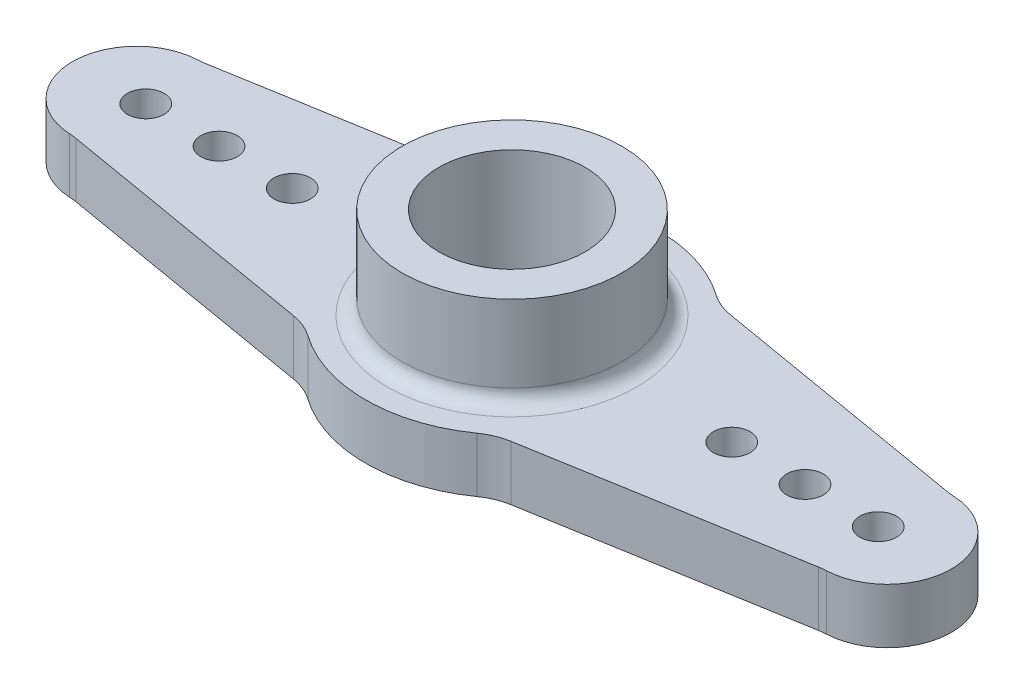
from build123d import *

# Parameters (mm, degrees)
BOSS_EXTRUDE1_DEPTH = 2.38125
FILLET1_R           = 2.54
FILLET2_R           = 2.54
SKETCH2_R           = 4.7625
BOSS_EXTRUDE2_DEPTH = 3.96875
FILLET3_R           = 0.635
SKETCH3_R           = 3.175
CUT_EXTRUDE1_DEPTH  = 6.35
SKETCH4_R           = 0.79375
CUT_EXTRUDE2_DEPTH  = 6.35


with BuildPart() as part:
    # Sketch1 → Boss-Extrude1 (new body)
    with BuildSketch(Plane(origin=(0, 0, 0), x_dir=(1, 0, 0), z_dir=(0, 1, 0))):
        with BuildLine():
            Line((4.089179599, 4.858097386), (16.271875, 2.778125))
            ThreePointArc((16.271875, 2.778125), (19.05, 0), (16.271875, -2.778125))
            Line((16.271875, -2.778125), (4.089179599, -4.858097386))
            ThreePointArc((4.089179599, -4.858097386), (0, -6.35), (-4.089179599, -4.858097386))
            Line((-4.089179599, -4.858097386), (-16.271875, -2.778125))
            ThreePointArc((-16.271875, -2.778125), (-19.05, 0), (-16.271875, 2.778125))
            Line((-16.271875, 2.778125), (-4.089179599, 4.858097386))
            ThreePointArc((-4.089179599, 4.858097386), (0, 6.35), (4.089179599, 4.858097386))
        make_face()
    extrude(amount=BOSS_EXTRUDE1_DEPTH)

    # Fillet1
    fillet1_edges = [part.edges().sort_by_distance(p)[0] for p in [
        (16.271875, 1.190625, -2.778125),
        (16.271875, 1.190625, 2.778125),
        (-16.271875, 1.190625, 2.778125),
        (-16.271875, 1.190625, -2.778125),
    ]]
    fillet(fillet1_edges, radius=FILLET1_R)

    # Fillet2
    fillet2_edges = [part.edges().sort_by_distance(p)[0] for p in [
        (4.089179599, 1.190625, -4.858097386),
        (4.089179599, 1.190625, 4.858097386),
        (-4.089179599, 1.190625, 4.858097386),
        (-4.089179599, 1.190625, -4.858097386),
    ]]
    fillet(fillet2_edges, radius=FILLET2_R)

    # Sketch2 → Boss-Extrude2 (add)
    with BuildSketch(Plane(origin=(0, 2.38125, 0), x_dir=(1, 0, 0), z_dir=(0, 1, 0))):
        with Locations(Location((0, 0, 0), (0, 0, 270))):
            Circle(SKETCH2_R)
    extrude(amount=BOSS_EXTRUDE2_DEPTH)

    # Fillet3
    fillet3_edges = [part.edges().sort_by_distance(p)[0] for p in [
        (0, 2.38125, -4.7625),
    ]]
    fillet(fillet3_edges, radius=FILLET3_R)

    # Sketch3 → Cut-Extrude1 (cut)
    with BuildSketch(Plane(origin=(0, 6.35, 0), x_dir=(1, 0, 0), z_dir=(0, 1, 0))):
        with Locations(Location((0, 0, 0), (0, 0, 270))):
            Circle(SKETCH3_R)
    extrude(amount=-CUT_EXTRUDE1_DEPTH, mode=Mode.SUBTRACT)

    # Sketch4 → Cut-Extrude2 (cut)
    with BuildSketch(Plane(origin=(0, 2.38125, 0), x_dir=(1, 0, 0), z_dir=(0, 1, 0))):
        with Locations(Location((9.525, 0, 0), (0, 0, 270))):
            Circle(SKETCH4_R)
        with Locations(Location((-9.525, 0, 0), (0, 0, 270))):
            Circle(SKETCH4_R)
        with Locations(Location((12.7, 0, 0), (0, 0, 270))):
            Circle(SKETCH4_R)
        with Locations(Location((15.875, 0, 0), (0, 0, 270))):
            Circle(SKETCH4_R)
        with Locations(Location((-12.7, 0, 0), (0, 0, 270))):
            Circle(SKETCH4_R)
        with Locations(Location((-15.875, 0, 0), (0, 0, 270))):
            Circle(SKETCH4_R)
    extrude(amount=-CUT_EXTRUDE2_DEPTH, mode=Mode.SUBTRACT)


solid = part.part
